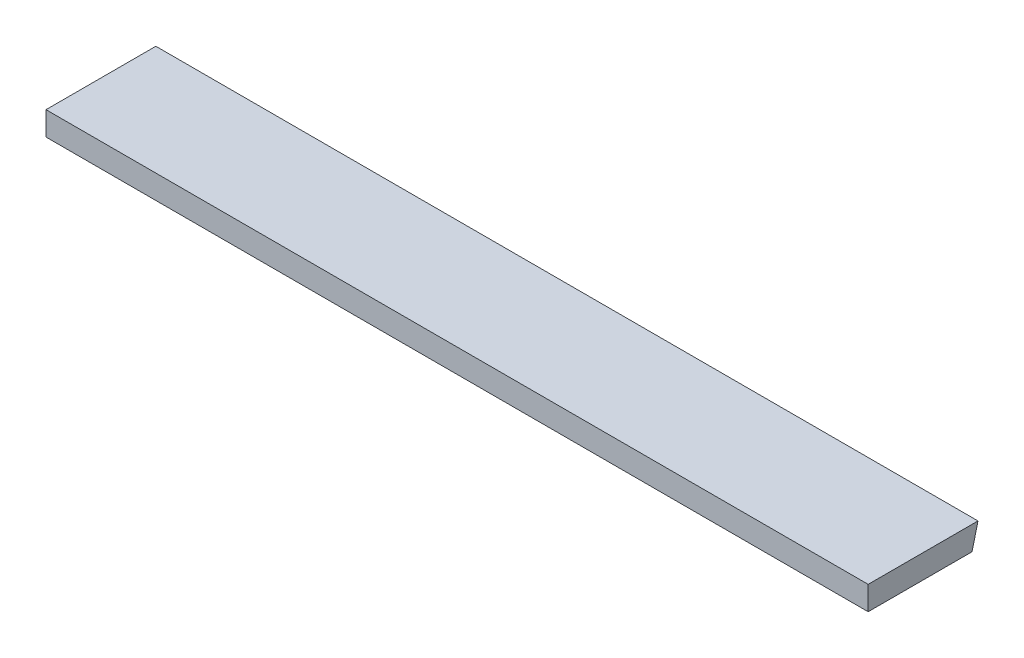
from build123d import *

# Parameters (mm, degrees)
SKETCH1_W           = 277
SKETCH1_H           = 35
BOSS_EXTRUDE1_DEPTH = 8
BOSS_EXTRUDE2_DEPTH = 277


with BuildPart() as part:
    # Sketch1 → Boss-Extrude1 (new body)
    with BuildSketch(Plane(origin=(0, 0, 0), x_dir=(1, 0, 0), z_dir=(0, 1, 0))):
        with Locations((45.227046926, 22.691286622)):
            Rectangle(SKETCH1_W, SKETCH1_H)
    extrude(amount=BOSS_EXTRUDE1_DEPTH)

    # Sketch2 → Boss-Extrude2 (add)
    with BuildSketch(Plane.ZY.offset(93.272953074)):
        Polygon((-40.191286622, 0), (-42.196295242, 8), (-40.191286622, 8), align=None)
    extrude(amount=-BOSS_EXTRUDE2_DEPTH)


solid = part.part
